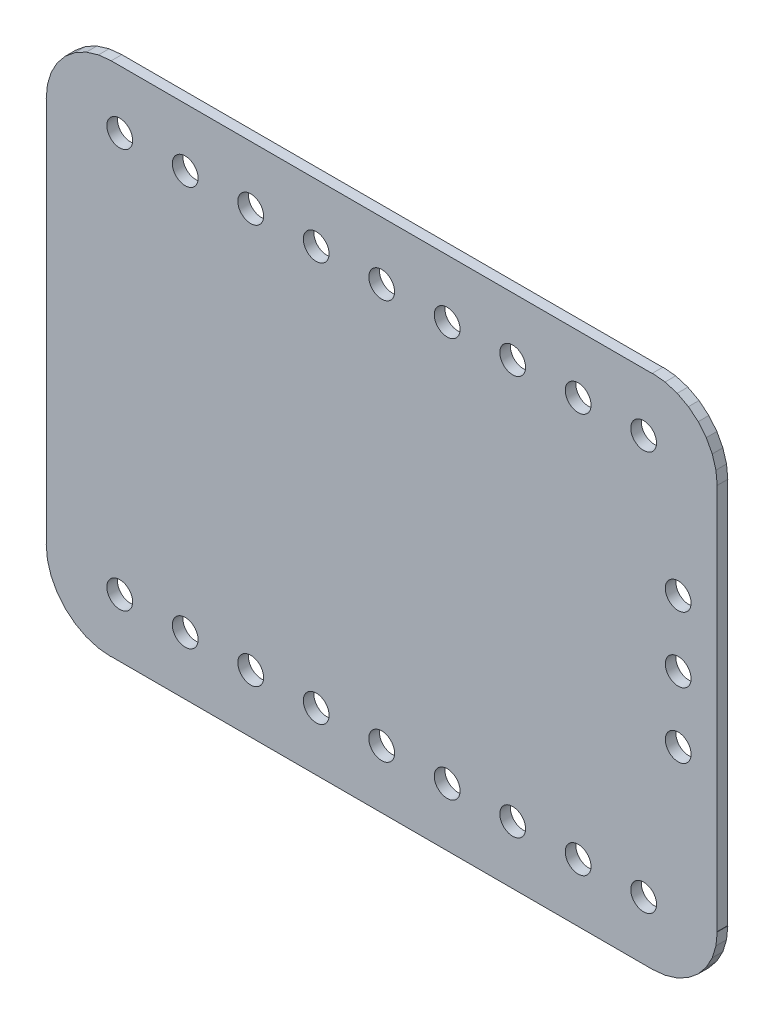
from build123d import *

# Parameters (mm, degrees)
SKETCH_1_R      = 0.499999
EXTRUDE_1_DEPTH = 0.41148


with BuildPart() as part:
    # 草图1 → 凸台-拉伸1 (new body)
    with BuildSketch(Plane.XY):
        Polygon((-23.99008664, 0.03617468), (-23.50000126, -0.01209548), (-23.50000126, 0), (-2.50000008, -0.01209548), (-2.0099147, 0.03617468), (-1.53866342, 0.17912588), (-1.1043539, 0.41126918), (-0.72367902, 0.72367902), (-0.41126918, 1.1043539), (-0.17912588, 1.53866342), (-0.03617468, 2.0099147), (0.01209548, 2.50000008), (-1.27e-05, 2.50000008), (-1.27e-05, 17.50001326), (0.01209548, 17.50000056), (-0.03617468, 17.99008594), (-0.17912588, 18.46133722), (-0.41126918, 18.89564674), (-0.72367902, 19.27632162), (-1.1043539, 19.58873146), (-1.53866342, 19.82087476), (-2.0099147, 19.96382596), (-2.50000008, 20.01209612), (-2.50000008, 20.000013333), (-23.492043121, 20.012146936), (-23.98367568, 19.9637269), (-24.45643572, 19.82031596), (-24.89213462, 19.58743098), (-25.27402616, 19.27401784), (-25.5874393, 18.8921263), (-25.82032428, 18.4564274), (-25.96373522, 17.98366736), (-26.01215524, 17.49201734), (-26.0000115, 17.49201734), (-26.0000115, 2.50001278), (-26.01209682, 2.50000008), (-25.96382666, 2.0099147), (-25.82087546, 1.53866342), (-25.58873216, 1.1043539), (-25.27632232, 0.72367902), (-24.89564744, 0.41126918), (-24.46133792, 0.17912588), align=None)
        with Locations(Location((-23.1599867, 17.74997974, 0), (0, 0, 180))):
            Circle(SKETCH_1_R, mode=Mode.SUBTRACT)
        with Locations(Location((-20.6199867, 17.74997974, 0), (0, 0, 180))):
            Circle(SKETCH_1_R, mode=Mode.SUBTRACT)
        with Locations(Location((-20.6199867, 2.24998534, 0), (0, 0, 180))):
            Circle(SKETCH_1_R, mode=Mode.SUBTRACT)
        with Locations(Location((-15.5399867, 17.74997974, 0), (0, 0, 180))):
            Circle(SKETCH_1_R, mode=Mode.SUBTRACT)
        with Locations(Location((-12.9999867, 17.74997974, 0), (0, 0, 180))):
            Circle(SKETCH_1_R, mode=Mode.SUBTRACT)
        with Locations(Location((-18.0799867, 17.74997974, 0), (0, 0, 180))):
            Circle(SKETCH_1_R, mode=Mode.SUBTRACT)
        with Locations(Location((-18.0799867, 2.24998534, 0), (0, 0, 180))):
            Circle(SKETCH_1_R, mode=Mode.SUBTRACT)
        with Locations(Location((-15.5399867, 2.24998534, 0), (0, 0, 180))):
            Circle(SKETCH_1_R, mode=Mode.SUBTRACT)
        with Locations(Location((-23.1599867, 2.24998534, 0), (0, 0, 180))):
            Circle(SKETCH_1_R, mode=Mode.SUBTRACT)
        with Locations(Location((-10.4599867, 2.24998534, 0), (0, 0, 180))):
            Circle(SKETCH_1_R, mode=Mode.SUBTRACT)
        with Locations(Location((-12.9999867, 2.24998534, 0), (0, 0, 180))):
            Circle(SKETCH_1_R, mode=Mode.SUBTRACT)
        with Locations(Location((-7.9199867, 17.74997974, 0), (0, 0, 180))):
            Circle(SKETCH_1_R, mode=Mode.SUBTRACT)
        with Locations(Location((-5.3799867, 17.74997974, 0), (0, 0, 180))):
            Circle(SKETCH_1_R, mode=Mode.SUBTRACT)
        with Locations(Location((-10.4599867, 17.74997974, 0), (0, 0, 180))):
            Circle(SKETCH_1_R, mode=Mode.SUBTRACT)
        with Locations(Location((-2.8399867, 17.74997974, 0), (0, 0, 180))):
            Circle(SKETCH_1_R, mode=Mode.SUBTRACT)
        with Locations(Location((-1.49999954, 13.03999932, 0), (0, 0, 180))):
            Circle(SKETCH_1_R, mode=Mode.SUBTRACT)
        with Locations(Location((-5.3799867, 2.24998534, 0), (0, 0, 180))):
            Circle(SKETCH_1_R, mode=Mode.SUBTRACT)
        with Locations(Location((-2.8399867, 2.24998534, 0), (0, 0, 180))):
            Circle(SKETCH_1_R, mode=Mode.SUBTRACT)
        with Locations(Location((-7.9199867, 2.24998534, 0), (0, 0, 180))):
            Circle(SKETCH_1_R, mode=Mode.SUBTRACT)
        with Locations(Location((-1.49999954, 10.49999932, 0), (0, 0, 180))):
            Circle(SKETCH_1_R, mode=Mode.SUBTRACT)
        with Locations(Location((-1.49999954, 7.95999932, 0), (0, 0, 180))):
            Circle(SKETCH_1_R, mode=Mode.SUBTRACT)
    extrude(amount=-EXTRUDE_1_DEPTH)


solid = part.part
